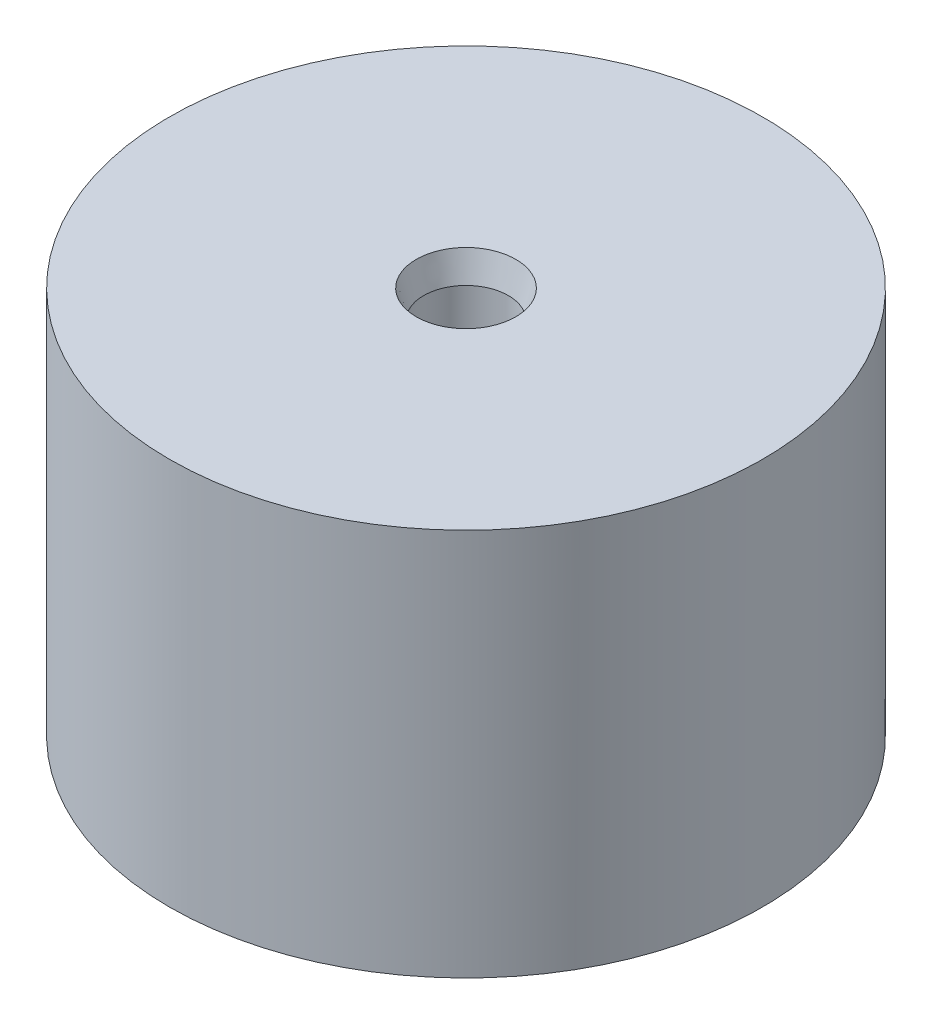
from build123d import *


with BuildPart() as part:
    # Sketch1 → Revolve1 (revolve)
    with BuildSketch(Plane.XY, mode=Mode.PRIVATE) as revolve1_sk:
        Polygon((-2, 2.5), (-2, -2.5), (-14, -14.5), (-14, 3.806217783), (-2.35, 3.806217783), align=None)
    revolve(revolve1_sk.sketch.rotate(Axis((0, 20.798274686, 0), (0, -1, 0)), 270), axis=Axis((0, 20.798274686, 0), (0, -1, 0)))


solid = part.part
